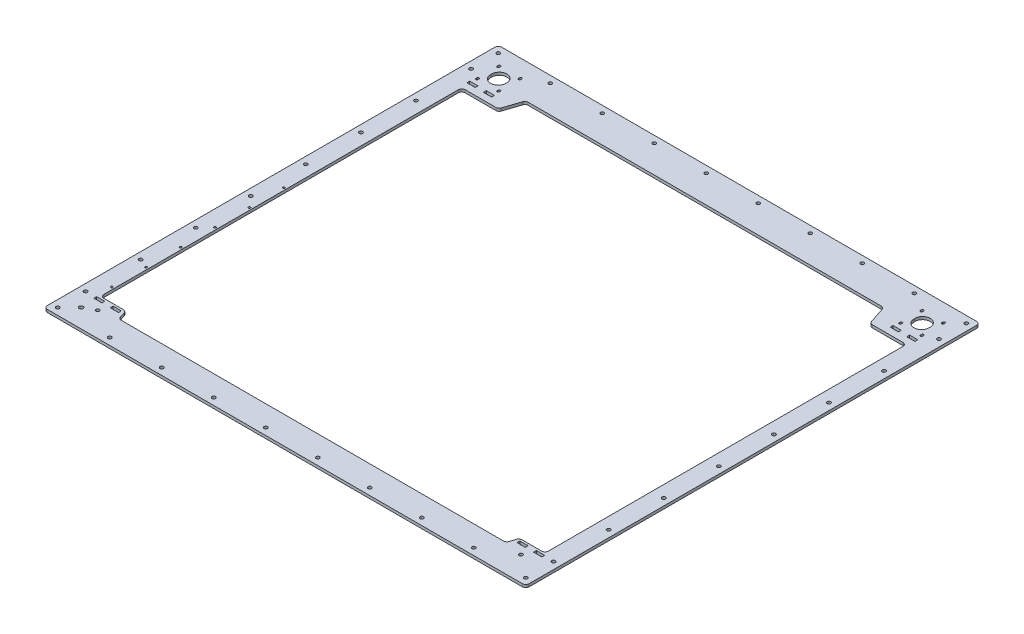
from build123d import *

# Parameters (mm, degrees)
SKETCH2_R           = 3
SKETCH2_R_2         = 2.55
SKETCH2_R_3         = 1.5
SKETCH2_W           = 12
SKETCH2_H           = 4.1
BOSS_EXTRUDE1_DEPTH = 4


with BuildPart() as part:
    # Sketch2 → Boss-Extrude1 (new body)
    with BuildSketch(Plane(origin=(0, 0, 0), x_dir=(1, 0, 0), z_dir=(0, 1, 0))):
        with BuildLine():
            Line((-329.25, 344.25), (360.75, 344.25))
            ThreePointArc((360.75, 344.25), (364.285533906, 342.785533906), (365.75, 339.25))
            Line((365.75, 339.25), (365.75, -310.75))
            ThreePointArc((365.75, -310.75), (364.285533906, -314.285533906), (360.75, -315.75))
            Line((360.75, -315.75), (-329.25, -315.75))
            ThreePointArc((-329.25, -315.75), (-332.785533906, -314.285533906), (-334.25, -310.75))
            Line((-334.25, -310.75), (-334.25, 339.25))
            ThreePointArc((-334.25, 339.25), (-332.785533906, 342.785533906), (-329.25, 344.25))
        make_face()
        with Locations(Location((-307.25, -288.75, 0), (0, 0, 270))):
            Circle(SKETCH2_R, mode=Mode.SUBTRACT)
        with Locations(Location((-324.25, 334.25, 0), (0, 0, 270))):
            Circle(SKETCH2_R_2, mode=Mode.SUBTRACT)
        with Locations(Location((-248.69, 334.25, 0), (0, 0, 270))):
            Circle(SKETCH2_R_2, mode=Mode.SUBTRACT)
        with Locations(Location((-173.13, 334.25, 0), (0, 0, 270))):
            Circle(SKETCH2_R_2, mode=Mode.SUBTRACT)
        with Locations(Location((-97.57, 334.25, 0), (0, 0, 270))):
            Circle(SKETCH2_R_2, mode=Mode.SUBTRACT)
        with Locations(Location((-22.01, 334.25, 0), (0, 0, 270))):
            Circle(SKETCH2_R_2, mode=Mode.SUBTRACT)
        with Locations(Location((53.55, 334.25, 0), (0, 0, 270))):
            Circle(SKETCH2_R_2, mode=Mode.SUBTRACT)
        with Locations(Location((129.11, 334.25, 0), (0, 0, 270))):
            Circle(SKETCH2_R_2, mode=Mode.SUBTRACT)
        with Locations(Location((204.67, 334.25, 0), (0, 0, 270))):
            Circle(SKETCH2_R_2, mode=Mode.SUBTRACT)
        with Locations(Location((280.23, 334.25, 0), (0, 0, 270))):
            Circle(SKETCH2_R_2, mode=Mode.SUBTRACT)
        with Locations(Location((355.79, 334.25, 0), (0, 0, 270))):
            Circle(SKETCH2_R_2, mode=Mode.SUBTRACT)
        with Locations(Location((355.79, -305.75, 0), (0, 0, 270))):
            Circle(SKETCH2_R_2, mode=Mode.SUBTRACT)
        with Locations(Location((280.23, -305.75, 0), (0, 0, 270))):
            Circle(SKETCH2_R_2, mode=Mode.SUBTRACT)
        with Locations(Location((204.67, -305.75, 0), (0, 0, 270))):
            Circle(SKETCH2_R_2, mode=Mode.SUBTRACT)
        with Locations(Location((129.11, -305.75, 0), (0, 0, 270))):
            Circle(SKETCH2_R_2, mode=Mode.SUBTRACT)
        with Locations(Location((53.55, -305.75, 0), (0, 0, 270))):
            Circle(SKETCH2_R_2, mode=Mode.SUBTRACT)
        with Locations(Location((-22.01, -305.75, 0), (0, 0, 270))):
            Circle(SKETCH2_R_2, mode=Mode.SUBTRACT)
        with Locations(Location((-97.57, -305.75, 0), (0, 0, 270))):
            Circle(SKETCH2_R_2, mode=Mode.SUBTRACT)
        with Locations(Location((-173.13, -305.75, 0), (0, 0, 270))):
            Circle(SKETCH2_R_2, mode=Mode.SUBTRACT)
        with Locations(Location((-248.69, -305.75, 0), (0, 0, 270))):
            Circle(SKETCH2_R_2, mode=Mode.SUBTRACT)
        with Locations(Location((-324.25, -305.75, 0), (0, 0, 270))):
            Circle(SKETCH2_R_2, mode=Mode.SUBTRACT)
        with Locations(Location((-324.25, 294.75, 0), (0, 0, 270))):
            Circle(SKETCH2_R_2, mode=Mode.SUBTRACT)
        with Locations(Location((-324.25, 214.75, 0), (0, 0, 270))):
            Circle(SKETCH2_R_2, mode=Mode.SUBTRACT)
        with Locations(Location((-324.25, 134.75, 0), (0, 0, 270))):
            Circle(SKETCH2_R_2, mode=Mode.SUBTRACT)
        with Locations(Location((-324.25, 54.75, 0), (0, 0, 270))):
            Circle(SKETCH2_R_2, mode=Mode.SUBTRACT)
        with Locations(Location((-324.25, -25.25, 0), (0, 0, 270))):
            Circle(SKETCH2_R_2, mode=Mode.SUBTRACT)
        with Locations(Location((-324.25, -105.25, 0), (0, 0, 270))):
            Circle(SKETCH2_R_2, mode=Mode.SUBTRACT)
        with Locations(Location((-324.25, -185.25, 0), (0, 0, 270))):
            Circle(SKETCH2_R_2, mode=Mode.SUBTRACT)
        with Locations(Location((-324.25, -265.25, 0), (0, 0, 270))):
            Circle(SKETCH2_R_2, mode=Mode.SUBTRACT)
        with Locations(Location((355.75, -265.25, 0), (0, 0, 270))):
            Circle(SKETCH2_R_2, mode=Mode.SUBTRACT)
        with Locations(Location((355.75, -185.25, 0), (0, 0, 270))):
            Circle(SKETCH2_R_2, mode=Mode.SUBTRACT)
        with Locations(Location((355.75, -105.25, 0), (0, 0, 270))):
            Circle(SKETCH2_R_2, mode=Mode.SUBTRACT)
        with Locations(Location((355.75, -25.25, 0), (0, 0, 270))):
            Circle(SKETCH2_R_2, mode=Mode.SUBTRACT)
        with Locations(Location((355.75, 54.75, 0), (0, 0, 270))):
            Circle(SKETCH2_R_2, mode=Mode.SUBTRACT)
        with Locations(Location((355.75, 134.75, 0), (0, 0, 270))):
            Circle(SKETCH2_R_2, mode=Mode.SUBTRACT)
        with Locations(Location((355.75, 214.75, 0), (0, 0, 270))):
            Circle(SKETCH2_R_2, mode=Mode.SUBTRACT)
        with Locations(Location((355.75, 294.75, 0), (0, 0, 270))):
            Circle(SKETCH2_R_2, mode=Mode.SUBTRACT)
        with Locations(Location((-291.75, -280.25, 0), (0, 0, 270))):
            Circle(SKETCH2_R_2, mode=Mode.SUBTRACT)
        with Locations(Location((323.25, -280.25, 0), (0, 0, 270))):
            Circle(SKETCH2_R_2, mode=Mode.SUBTRACT)
        with Locations(Location((-310.75, -240.75, 0), (0, 0, 270))):
            Circle(SKETCH2_R_3, mode=Mode.SUBTRACT)
        with Locations(Location((-310.75, -190.75, 0), (0, 0, 270))):
            Circle(SKETCH2_R_3, mode=Mode.SUBTRACT)
        with Locations(Location((-310.75, -140.75, 0), (0, 0, 270))):
            Circle(SKETCH2_R_3, mode=Mode.SUBTRACT)
        with Locations(Location((-310.75, -90.75, 0), (0, 0, 270))):
            Circle(SKETCH2_R_3, mode=Mode.SUBTRACT)
        with Locations(Location((-310.75, -40.75, 0), (0, 0, 270))):
            Circle(SKETCH2_R_3, mode=Mode.SUBTRACT)
        with Locations(Location((-310.75, 9.25, 0), (0, 0, 270))):
            Circle(SKETCH2_R_3, mode=Mode.SUBTRACT)
        with BuildLine():
            Line((-305.65, 287.85), (-305.65, 286.25))
            ThreePointArc((-305.65, 286.25), (-307.25, 284.65), (-308.85, 286.25))
            Line((-308.85, 286.25), (-308.85, 287.85))
            ThreePointArc((-308.85, 287.85), (-307.25, 289.45), (-305.65, 287.85))
        make_face(mode=Mode.SUBTRACT)
        with BuildLine():
            Line((-274.65, 287.85), (-274.65, 286.25))
            ThreePointArc((-274.65, 286.25), (-276.25, 284.65), (-277.85, 286.25))
            Line((-277.85, 286.25), (-277.85, 287.85))
            ThreePointArc((-277.85, 287.85), (-276.25, 289.45), (-274.65, 287.85))
        make_face(mode=Mode.SUBTRACT)
        with BuildLine():
            Line((289.3537961, 264.25), (333.75, 264.25))
            ThreePointArc((333.75, 264.25), (337.285533906, 262.785533906), (338.75, 259.25))
            Line((338.75, 259.25), (338.75, -255.75))
            ThreePointArc((338.75, -255.75), (337.285533906, -259.285533906), (333.75, -260.75))
            Line((333.75, -260.75), (305.445601408, -260.75))
            ThreePointArc((305.445601408, -260.75), (302.473672504, -261.729099779), (300.665669573, -264.282944564))
            Line((300.665669573, -264.282944564), (298.230534327, -272.217055436))
            ThreePointArc((298.230534327, -272.217055436), (296.422531396, -274.770900221), (293.450602492, -275.75))
            Line((293.450602492, -275.75), (-261.950602492, -275.75))
            ThreePointArc((-261.950602492, -275.75), (-264.922531396, -274.770900221), (-266.730534327, -272.217055436))
            Line((-266.730534327, -272.217055436), (-269.165669573, -264.282944564))
            ThreePointArc((-269.165669573, -264.282944564), (-270.973672504, -261.729099779), (-273.945601408, -260.75))
            Line((-273.945601408, -260.75), (-302.25, -260.75))
            ThreePointArc((-302.25, -260.75), (-305.785533906, -259.285533906), (-307.25, -255.75))
            Line((-307.25, -255.75), (-307.25, 259.25))
            ThreePointArc((-307.25, 259.25), (-305.785533906, 262.785533906), (-302.25, 264.25))
            Line((-302.25, 264.25), (-257.8537961, 264.25))
            ThreePointArc((-257.8537961, 264.25), (-254.930244677, 265.193789074), (-253.11037961, 267.66886117))
            Line((-253.11037961, 267.66886117), (-245.38962039, 290.83113883))
            ThreePointArc((-245.38962039, 290.83113883), (-243.569755323, 293.306210926), (-240.6462039, 294.25))
            Line((-240.6462039, 294.25), (272.1462039, 294.25))
            ThreePointArc((272.1462039, 294.25), (275.069755323, 293.306210926), (276.88962039, 290.83113883))
            Line((276.88962039, 290.83113883), (284.61037961, 267.66886117))
            ThreePointArc((284.61037961, 267.66886117), (286.430244677, 265.193789074), (289.3537961, 264.25))
        make_face(mode=Mode.SUBTRACT)
        with BuildLine():
            Line((-274.65, 318.85), (-274.65, 317.25))
            ThreePointArc((-274.65, 317.25), (-276.25, 315.65), (-277.85, 317.25))
            Line((-277.85, 317.25), (-277.85, 318.85))
            ThreePointArc((-277.85, 318.85), (-276.25, 320.45), (-274.65, 318.85))
        make_face(mode=Mode.SUBTRACT)
        with BuildLine():
            Line((-305.65, 318.85), (-305.65, 317.25))
            ThreePointArc((-305.65, 317.25), (-307.25, 315.65), (-308.85, 317.25))
            Line((-308.85, 317.25), (-308.85, 318.85))
            ThreePointArc((-308.85, 318.85), (-307.25, 320.45), (-305.65, 318.85))
        make_face(mode=Mode.SUBTRACT)
        with BuildLine():
            Line((309.35, 287.85), (309.35, 286.25))
            ThreePointArc((309.35, 286.25), (307.75, 284.65), (306.15, 286.25))
            Line((306.15, 286.25), (306.15, 287.85))
            ThreePointArc((306.15, 287.85), (307.75, 289.45), (309.35, 287.85))
        make_face(mode=Mode.SUBTRACT)
        with BuildLine():
            Line((-280.7, 303.35), (-280.7, 301.75))
            ThreePointArc((-280.7, 301.75), (-291.75, 290.7), (-302.8, 301.75))
            Line((-302.8, 301.75), (-302.8, 303.35))
            ThreePointArc((-302.8, 303.35), (-291.75, 314.4), (-280.7, 303.35))
        make_face(mode=Mode.SUBTRACT)
        with BuildLine():
            Line((340.35, 287.85), (340.35, 286.25))
            ThreePointArc((340.35, 286.25), (338.75, 284.65), (337.15, 286.25))
            Line((337.15, 286.25), (337.15, 287.85))
            ThreePointArc((337.15, 287.85), (338.75, 289.45), (340.35, 287.85))
        make_face(mode=Mode.SUBTRACT)
        with BuildLine():
            Line((340.35, 318.85), (340.35, 317.25))
            ThreePointArc((340.35, 317.25), (338.75, 315.65), (337.15, 317.25))
            Line((337.15, 317.25), (337.15, 318.85))
            ThreePointArc((337.15, 318.85), (338.75, 320.45), (340.35, 318.85))
        make_face(mode=Mode.SUBTRACT)
        with BuildLine():
            Line((309.35, 318.85), (309.35, 317.25))
            ThreePointArc((309.35, 317.25), (307.75, 315.65), (306.15, 317.25))
            Line((306.15, 317.25), (306.15, 318.85))
            ThreePointArc((306.15, 318.85), (307.75, 320.45), (309.35, 318.85))
        make_face(mode=Mode.SUBTRACT)
        with BuildLine():
            Line((334.3, 303.35), (334.3, 301.75))
            ThreePointArc((334.3, 301.75), (323.25, 290.7), (312.2, 301.75))
            Line((312.2, 301.75), (312.2, 303.35))
            ThreePointArc((312.2, 303.35), (323.25, 314.4), (334.3, 303.35))
        make_face(mode=Mode.SUBTRACT)
        with Locations((311.25, -265.91365791)):
            Rectangle(SKETCH2_W, SKETCH2_H, mode=Mode.SUBTRACT)
        with Locations((311.25, 276.3)):
            Rectangle(SKETCH2_W, SKETCH2_H, mode=Mode.SUBTRACT)
        with Locations((-303.75, 276.3)):
            Rectangle(SKETCH2_W, SKETCH2_H, mode=Mode.SUBTRACT)
        with Locations((-279.75, 276.3)):
            Rectangle(SKETCH2_W, SKETCH2_H, mode=Mode.SUBTRACT)
        with Locations((335.25, 276.3)):
            Rectangle(SKETCH2_W, SKETCH2_H, mode=Mode.SUBTRACT)
        with Locations((335.25, -265.91365791)):
            Rectangle(SKETCH2_W, SKETCH2_H, mode=Mode.SUBTRACT)
        with Locations((-303.75, -265.91365791)):
            Rectangle(SKETCH2_W, SKETCH2_H, mode=Mode.SUBTRACT)
        with Locations((-279.75, -265.91365791)):
            Rectangle(SKETCH2_W, SKETCH2_H, mode=Mode.SUBTRACT)
    extrude(amount=BOSS_EXTRUDE1_DEPTH)


solid = part.part
